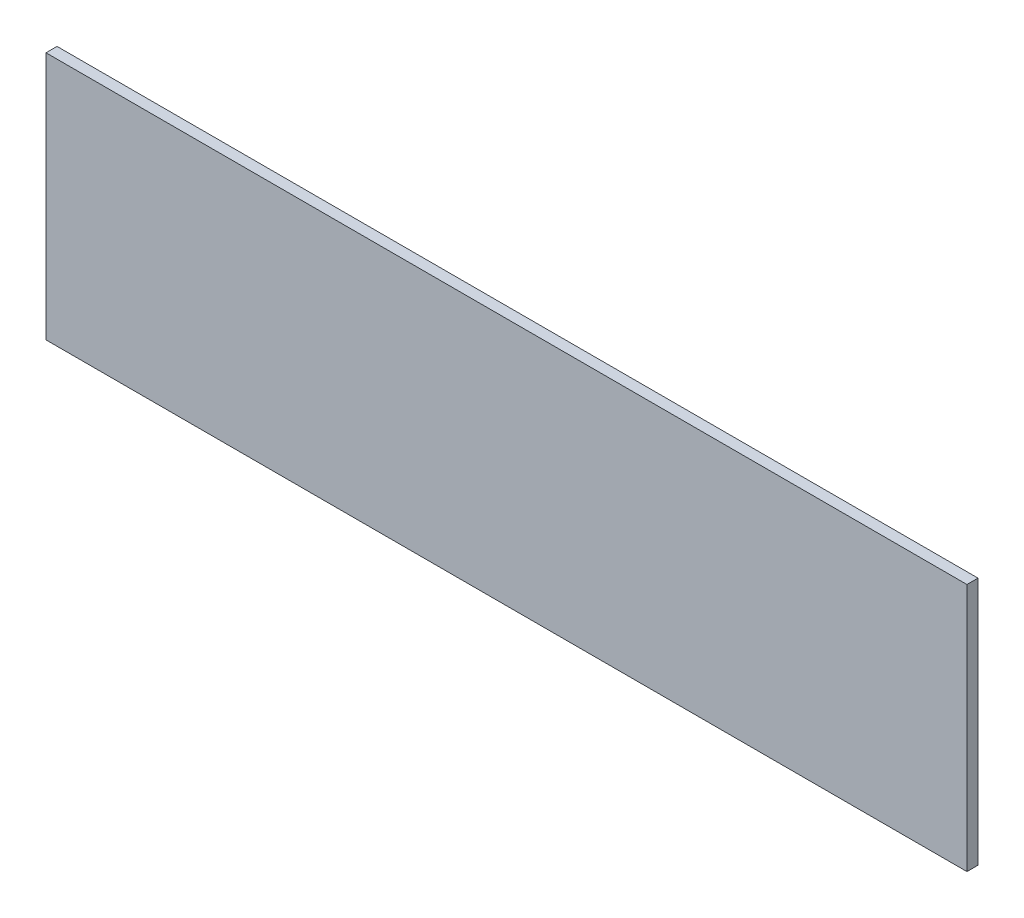
from build123d import *

# Parameters (mm, degrees)
SKETCH1_W           = 500
SKETCH1_H           = 135
BOSS_EXTRUDE1_DEPTH = 6


with BuildPart() as part:
    # Sketch1 → Boss-Extrude1 (new body)
    with BuildSketch(Plane.XY):
        with Locations((250, 67.5)):
            Rectangle(SKETCH1_W, SKETCH1_H)
    extrude(amount=BOSS_EXTRUDE1_DEPTH)


solid = part.part
